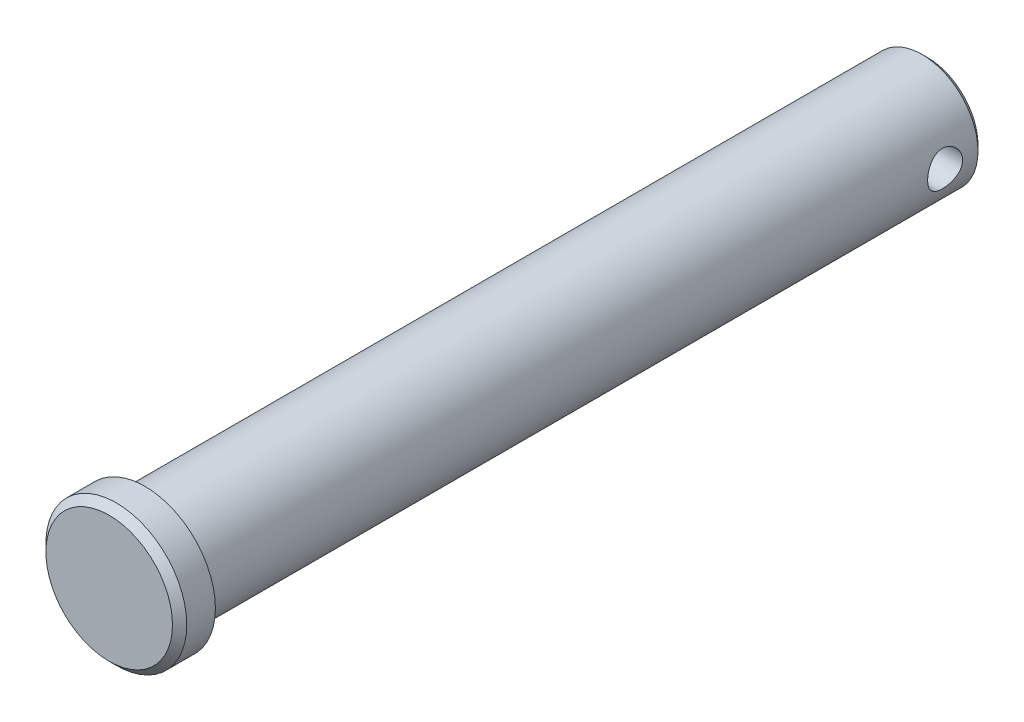
from build123d import *

# Parameters (mm, degrees)
SKETCH1_R           = 6.35
EXTRUDE1_DEPTH      = 44.45
SKETCH2_R           = 8.001
EXTRUDE2_DEPTH      = 4.064
CHAMFER1_SIZE       = 0.8128
EXTRUDE3_DEPTH      = 50.816063654
EXTRUDE3_DEPTH_BACK = 50.816063654
SKETCH3_R           = 1.984375
CHAMFER2_SIZE       = 0.635


with BuildPart() as part:
    # Sketch1 → Extrude1 (new, symmetric)
    with BuildSketch(Plane.XY):
        Circle(SKETCH1_R)
    extrude(amount=EXTRUDE1_DEPTH, both=True)

    # Sketch2 → Extrude2 (add)
    with BuildSketch(Plane.XY.offset(44.45)):
        Circle(SKETCH2_R)
    extrude(amount=EXTRUDE2_DEPTH)

    # Chamfer1
    chamfer1_edges = [part.edges().sort_by_distance(p)[0] for p in [
        (-8.001, 0, 48.514),
    ]]
    chamfer(chamfer1_edges, length=CHAMFER1_SIZE)

    # Sketch3 → Extrude3 (cut, two sides: drawn at the far end of the back side and taken through both)
    with BuildSketch(Plane(origin=(0, 0, 0), x_dir=(0, 0, -1), z_dir=(1, 0, 0)).offset(-EXTRUDE3_DEPTH_BACK)):
        with Locations(Location((40.084375, 0, 0), (0, 0, 179.999999999))):
            Circle(SKETCH3_R)
    extrude(amount=EXTRUDE3_DEPTH + EXTRUDE3_DEPTH_BACK, mode=Mode.SUBTRACT)

    # Chamfer2
    chamfer2_edges = [part.edges().sort_by_distance(p)[0] for p in [
        (-6.35, 0, -44.45),
    ]]
    chamfer(chamfer2_edges, length=CHAMFER2_SIZE)


solid = part.part
